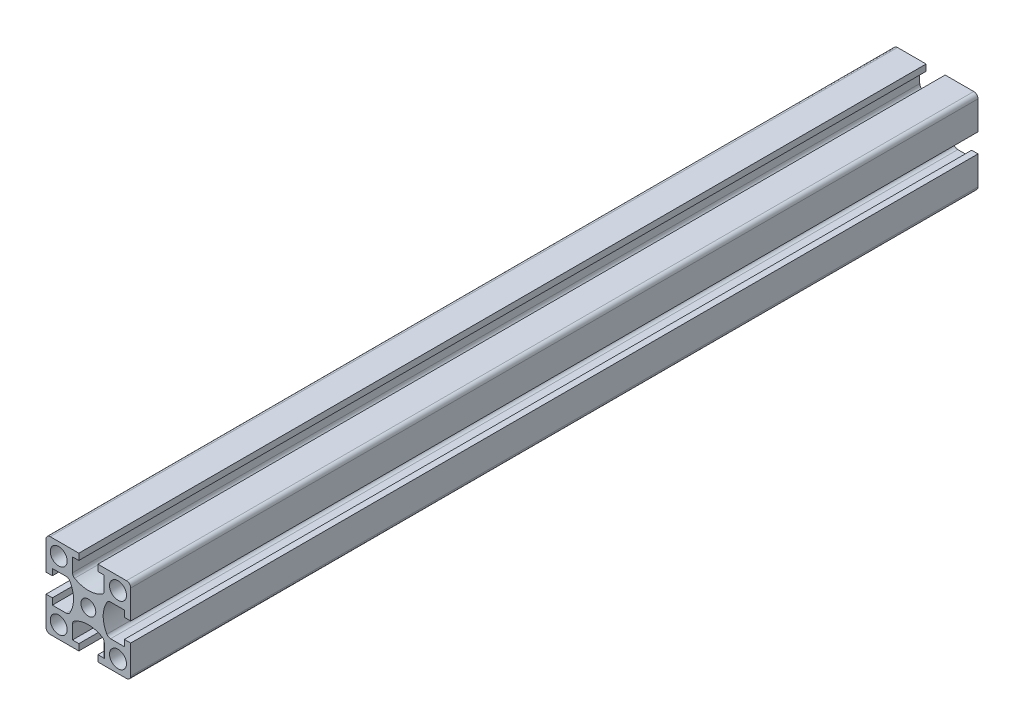
from build123d import *

# Parameters (mm, degrees)
SKETCH1_R           = 5
SKETCH1_R_2         = 4.375
BOSS_EXTRUDE1_DEPTH = 500


with BuildPart() as part:
    # Sketch1 → Boss-Extrude1 (new body)
    with BuildSketch(Plane.XY):
        with BuildLine():
            Line((-25, 22.5), (-25, 5.625))
            Line((-25, 5.625), (-21.25, 5.625))
            Line((-21.25, 5.625), (-21.25, 9.375))
            Line((-21.25, 9.375), (-13.092150698, 9.375))
            ThreePointArc((-13.092150698, 9.375), (-11.842150698, 9.040063509), (-10.927087189, 8.125))
            ThreePointArc((-10.927087189, 8.125), (-8.75, 0), (-10.927087189, -8.125))
            ThreePointArc((-10.927087189, -8.125), (-11.842150698, -9.040063509), (-13.092150698, -9.375))
            Line((-13.092150698, -9.375), (-21.25, -9.375))
            Line((-21.25, -9.375), (-21.25, -5.625))
            Line((-21.25, -5.625), (-25, -5.625))
            Line((-25, -5.625), (-25, -22.5))
            ThreePointArc((-25, -22.5), (-24.267766953, -24.267766953), (-22.5, -25))
            Line((-22.5, -25), (-5.625, -25))
            Line((-5.625, -25), (-5.625, -21.25))
            Line((-5.625, -21.25), (-9.375, -21.25))
            Line((-9.375, -21.25), (-9.375, -13.092150698))
            ThreePointArc((-9.375, -13.092150698), (-9.040063509, -11.842150698), (-8.125, -10.927087189))
            ThreePointArc((-8.125, -10.927087189), (0, -8.75), (8.125, -10.927087189))
            ThreePointArc((8.125, -10.927087189), (9.040063509, -11.842150698), (9.375, -13.092150698))
            Line((9.375, -13.092150698), (9.375, -21.25))
            Line((9.375, -21.25), (5.625, -21.25))
            Line((5.625, -21.25), (5.625, -25))
            Line((5.625, -25), (22.5, -25))
            ThreePointArc((22.5, -25), (24.267766953, -24.267766953), (25, -22.5))
            Line((25, -22.5), (25, -5.625))
            Line((25, -5.625), (21.25, -5.625))
            Line((21.25, -5.625), (21.25, -9.375))
            Line((21.25, -9.375), (13.092150698, -9.375))
            ThreePointArc((13.092150698, -9.375), (11.842150698, -9.040063509), (10.927087189, -8.125))
            ThreePointArc((10.927087189, -8.125), (8.75, 0), (10.927087189, 8.125))
            ThreePointArc((10.927087189, 8.125), (11.842150698, 9.040063509), (13.092150698, 9.375))
            Line((13.092150698, 9.375), (21.25, 9.375))
            Line((21.25, 9.375), (21.25, 5.625))
            Line((21.25, 5.625), (25, 5.625))
            Line((25, 5.625), (25, 22.5))
            ThreePointArc((25, 22.5), (24.267766953, 24.267766953), (22.5, 25))
            Line((22.5, 25), (5.625, 25))
            Line((5.625, 25), (5.625, 21.25))
            Line((5.625, 21.25), (9.375, 21.25))
            Line((9.375, 21.25), (9.375, 13.092150698))
            ThreePointArc((9.375, 13.092150698), (9.040063509, 11.842150698), (8.125, 10.927087189))
            ThreePointArc((8.125, 10.927087189), (0, 8.75), (-8.125, 10.927087189))
            ThreePointArc((-8.125, 10.927087189), (-9.040063509, 11.842150698), (-9.375, 13.092150698))
            Line((-9.375, 13.092150698), (-9.375, 21.25))
            Line((-9.375, 21.25), (-5.625, 21.25))
            Line((-5.625, 21.25), (-5.625, 25))
            Line((-5.625, 25), (-22.5, 25))
            ThreePointArc((-22.5, 25), (-24.267766953, 24.267766953), (-25, 22.5))
        make_face()
        with Locations((-17.5, -17.5)):
            Circle(SKETCH1_R, mode=Mode.SUBTRACT)
        with Locations((17.5, -17.5)):
            Circle(SKETCH1_R, mode=Mode.SUBTRACT)
        with Locations((17.5, 17.5)):
            Circle(SKETCH1_R, mode=Mode.SUBTRACT)
        Circle(SKETCH1_R_2, mode=Mode.SUBTRACT)
        with Locations((-17.5, 17.5)):
            Circle(SKETCH1_R, mode=Mode.SUBTRACT)
    extrude(amount=BOSS_EXTRUDE1_DEPTH)


solid = part.part
